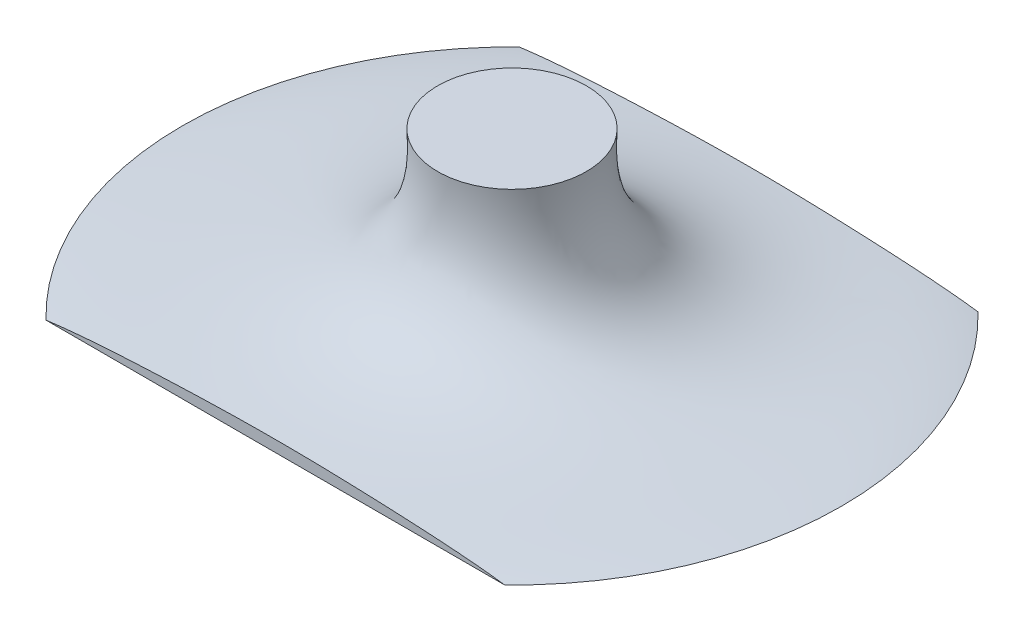
from build123d import *

# Parameters (mm, degrees)
CUT_EXTRUDE1_DEPTH      = 147.001712485
CUT_EXTRUDE1_DEPTH_BACK = 100
SKETCH3_W               = 250
SKETCH3_H               = 36


with BuildPart() as part:
    # Sketch2 → Revolve1 (revolve)
    with BuildSketch(Plane.XY):
        with BuildLine():
            Line((0, -24), (97.5, -24))
            add(Edge.make_bspline(
                [(97.5, -24), (66.701854607, -17.999104975), (18.636953843, -25.17360245), (22, 24)],
                knots=[0, 0, 0, 0, 1, 1, 1, 1], degree=3))
            Line((22, 24), (0, 24))
            Line((0, 24), (0, -24))
        make_face()
    revolve(axis=Axis((0, -24, 0), (0, 1, 0)))

    # Sketch3 → Cut-Extrude1 (cut, two sides: drawn at the far end of the back side and taken through both)
    with BuildSketch(Plane(origin=(0, 24, 0), x_dir=(1, 0, 0), z_dir=(0, 1, 0)).offset(-CUT_EXTRUDE1_DEPTH_BACK)):
        with Locations((0, 88)):
            Rectangle(SKETCH3_W, SKETCH3_H)
        with Locations((0, -88)):
            Rectangle(SKETCH3_W, SKETCH3_H)
    extrude(amount=CUT_EXTRUDE1_DEPTH + CUT_EXTRUDE1_DEPTH_BACK, mode=Mode.SUBTRACT)


solid = part.part
